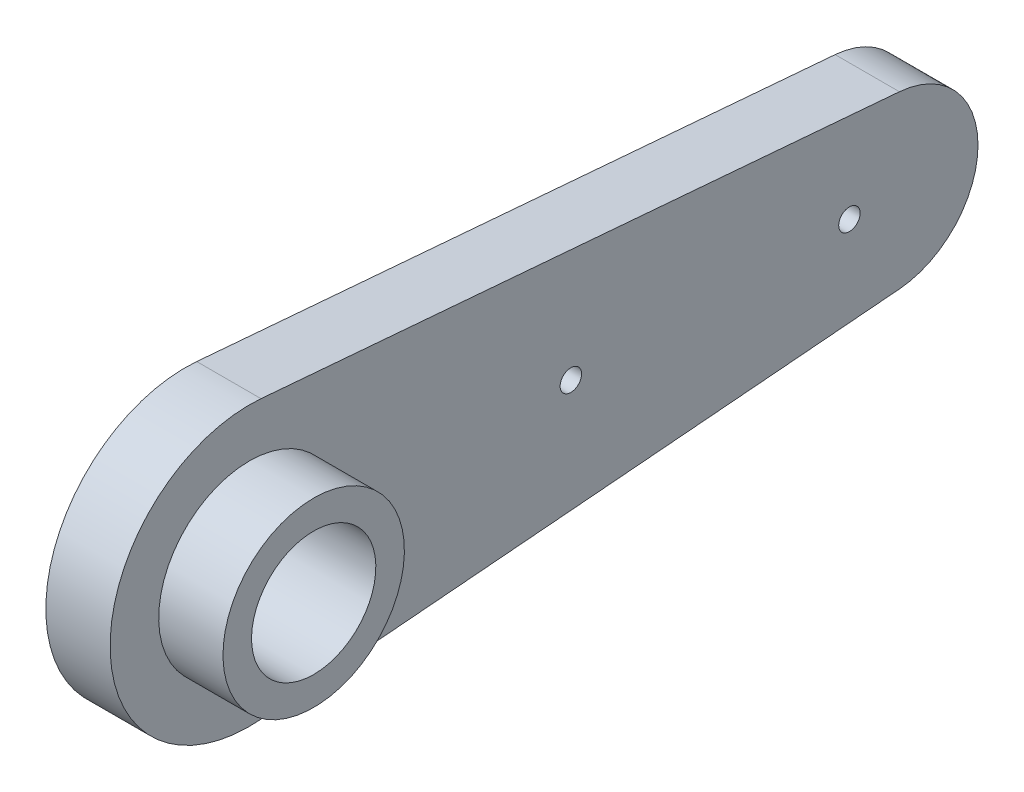
from build123d import *

# Parameters (mm, degrees)
ESQUISSE1_R             = 2.9
ESQUISSE1_R_2           = 0.5
BOSS_EXTRU_1_DEPTH      = 6
ESQUISSE2_R             = 4.232956527
ENL_V_MAT_EXTRU_1_DEPTH = 3


with BuildPart() as part:
    # Esquisse1 → Boss.-Extru.1 (new body)
    with BuildSketch(Plane.ZY.offset(-51.2)):
        with BuildLine():
            Line((-16.960725558, -57.422608764), (-46.752392225, -59.913913086))
            ThreePointArc((-46.752392225, -59.913913086), (-50.419058892, -63.9), (-46.752392225, -67.886086914))
            Line((-46.752392225, -67.886086914), (-16.960725558, -70.377391236))
            ThreePointArc((-16.960725558, -70.377391236), (-9.919058892, -63.9), (-16.960725558, -57.422608764))
        make_face()
        with Locations(Location((-16.419058892, -63.9, 0), (0, 0, 270))):
            Circle(ESQUISSE1_R, mode=Mode.SUBTRACT)
        with Locations(Location((-31.419058892, -63.9, 0), (0, 0, 270))):
            Circle(ESQUISSE1_R_2, mode=Mode.SUBTRACT)
        with Locations(Location((-44.419058892, -63.9, 0), (0, 0, 270))):
            Circle(ESQUISSE1_R_2, mode=Mode.SUBTRACT)
    extrude(amount=BOSS_EXTRU_1_DEPTH)

    # Esquisse2 → Enlèv. mat.-Extru.1 (cut)
    with BuildSketch(Plane(origin=(51.2, 0, 0), x_dir=(0, 0, -1), z_dir=(1, 0, 0))):
        with BuildLine():
            Line((16.960725558, -70.377391236), (46.752392225, -67.886086914))
            ThreePointArc((46.752392225, -67.886086914), (50.419058892, -63.9), (46.752392225, -59.913913086))
            Line((46.752392225, -59.913913086), (16.960725558, -57.422608764))
            ThreePointArc((16.960725558, -57.422608764), (9.919058892, -63.9), (16.960725558, -70.377391236))
        make_face()
        with Locations(Location((16.419058892, -63.9, 0), (0, 0, 90))):
            Circle(ESQUISSE2_R, mode=Mode.SUBTRACT)
    extrude(amount=-ENL_V_MAT_EXTRU_1_DEPTH, mode=Mode.SUBTRACT)


solid = part.part
